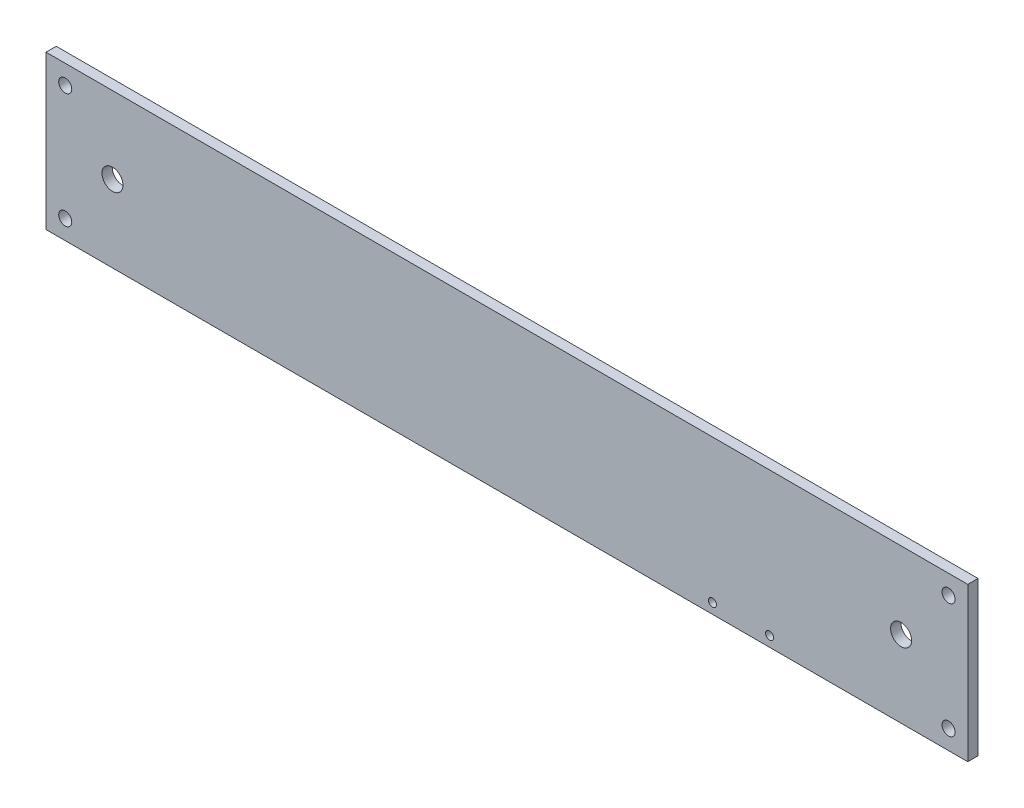
from build123d import *

# Parameters (mm, degrees)
SKETCH1_W           = 360
SKETCH1_H           = 60
SKETCH1_R           = 4.1
SKETCH1_R_2         = 2.55
BOSS_EXTRUDE1_DEPTH = 4
SKETCH3_R           = 1.55
CUT_EXTRUDE2_DEPTH  = 4


with BuildPart() as part:
    # Sketch1 → Boss-Extrude1 (new body)
    with BuildSketch(Plane.XY):
        with Locations((154.041275094, 0)):
            Rectangle(SKETCH1_W, SKETCH1_H)
        Circle(SKETCH1_R, mode=Mode.SUBTRACT)
        with Locations((308, 0)):
            Circle(SKETCH1_R, mode=Mode.SUBTRACT)
        with Locations((-18.451377883, 22.492652976)):
            Circle(SKETCH1_R_2, mode=Mode.SUBTRACT)
        with Locations((-18.451377883, -22.492652976)):
            Circle(SKETCH1_R_2, mode=Mode.SUBTRACT)
        with Locations((326.53392807, 22.492652976)):
            Circle(SKETCH1_R_2, mode=Mode.SUBTRACT)
        with Locations((326.53392807, -22.492652976)):
            Circle(SKETCH1_R_2, mode=Mode.SUBTRACT)
    extrude(amount=BOSS_EXTRUDE1_DEPTH)

    # Sketch3 → Cut-Extrude2 (cut)
    with BuildSketch(Plane.XY.offset(4)):
        with Locations((256.65, -26)):
            Circle(SKETCH3_R)
        with Locations((234.35, -26)):
            Circle(SKETCH3_R)
    extrude(amount=-CUT_EXTRUDE2_DEPTH, mode=Mode.SUBTRACT)


solid = part.part
